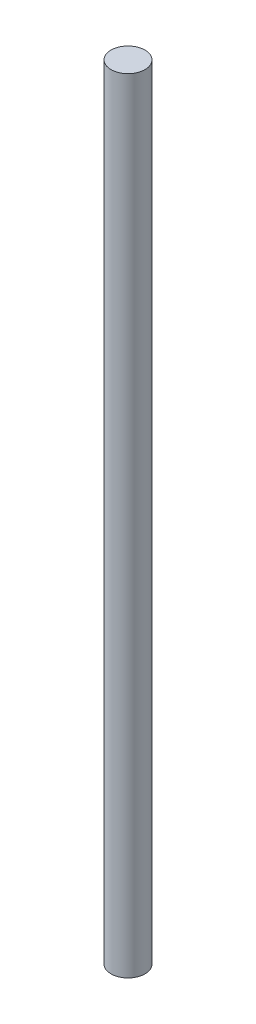
from build123d import *

# Parameters (mm, degrees)
SKETCH1_R           = 1.651
BOSS_EXTRUDE1_DEPTH = 76.2


with BuildPart() as part:
    # Sketch1 → Boss-Extrude1 (new body)
    with BuildSketch(Plane(origin=(0, 0, 0), x_dir=(1, 0, 0), z_dir=(0, 1, 0))):
        with Locations(Location((0, 0, 0), (0, 0, 90))):
            Circle(SKETCH1_R)
    extrude(amount=BOSS_EXTRUDE1_DEPTH)


solid = part.part
